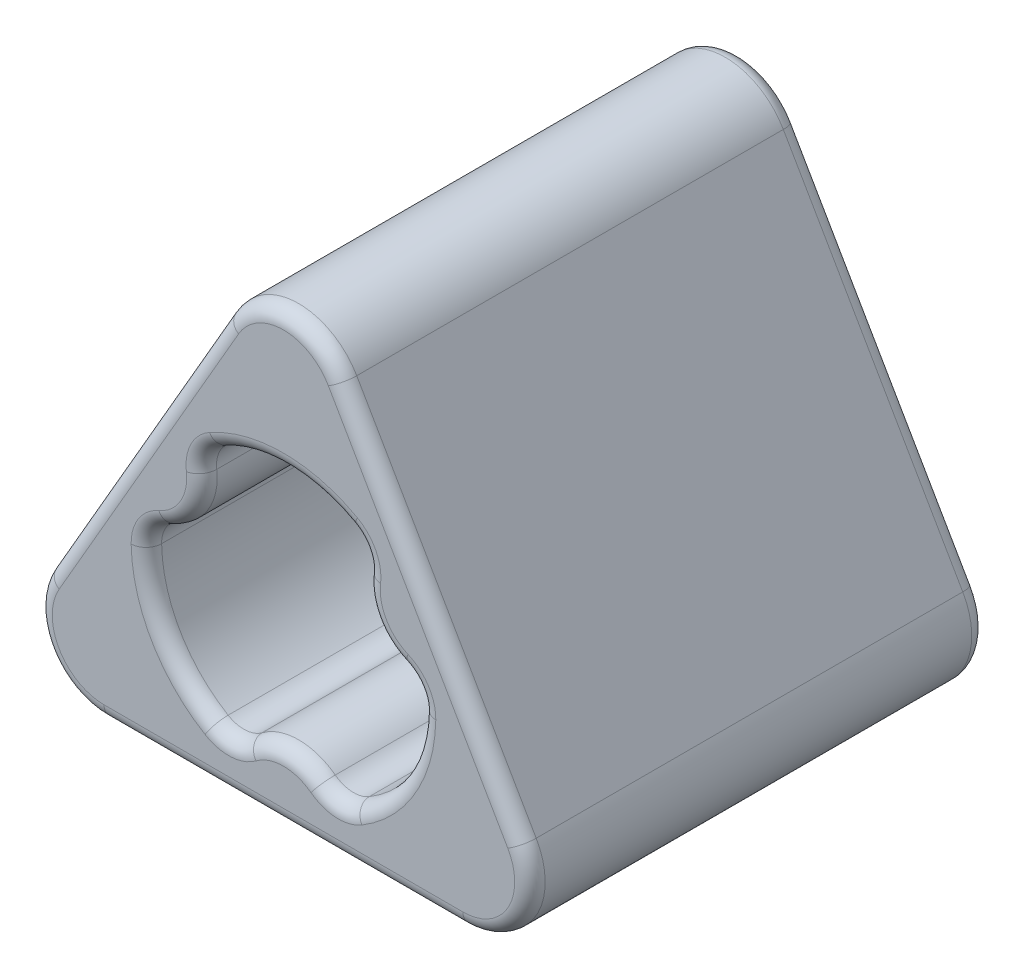
from build123d import *

# Parameters (mm, degrees)
EXTRUDE_1_DEPTH = 15
FILLET_1_R      = 2.2
FILLET_2_R      = 1
FILLET_3_R      = 0.5


with BuildPart() as part:
    # 스케치1 → 보스-돌출1 (new body)
    with BuildSketch(Plane.XY):
        Polygon((0, 11.2), (-9.699484522, -5.6), (9.699484522, -5.6), align=None)
        with BuildLine():
            ThreePointArc((-2.839585183, 3.49095345), (0, 4.5), (2.839585183, 3.49095345))
            ThreePointArc((2.839585183, 3.49095345), (2.944486373, 1.7), (4.443046962, 0.71367618))
            ThreePointArc((4.443046962, 0.71367618), (3.897114317, -2.25), (1.603461779, -4.20462963))
            ThreePointArc((1.603461779, -4.20462963), (0, -3.4), (-1.603461779, -4.20462963))
            ThreePointArc((-1.603461779, -4.20462963), (-3.897114317, -2.25), (-4.443046962, 0.71367618))
            ThreePointArc((-4.443046962, 0.71367618), (-2.944486373, 1.7), (-2.839585183, 3.49095345))
        make_face(mode=Mode.SUBTRACT)
    extrude(amount=EXTRUDE_1_DEPTH)

    # 필렛1
    fillet_1_edges = [part.edges().sort_by_distance(p)[0] for p in [
        (-9.699484522, -5.6, 7.5),
        (9.699484522, -5.6, 7.5),
        (0, 11.2, 7.5),
    ]]
    fillet(fillet_1_edges, radius=FILLET_1_R)

    # 필렛2
    fillet_2_edges = [part.edges().sort_by_distance(p)[0] for p in [
        (2.839585183, 3.49095345, 7.5),
        (4.443046962, 0.71367618, 7.5),
        (1.603461779, -4.20462963, 7.5),
        (-1.603461779, -4.20462963, 7.5),
        (-4.443046962, 0.71367618, 7.5),
        (-2.839585183, 3.49095345, 7.5),
    ]]
    fillet(fillet_2_edges, radius=FILLET_2_R)

    # 필렛3
    fillet_3_edges = [part.edges().sort_by_distance(p)[0] for p in [
        (7.794228634, -4.5, 0),
        (0, -5.6, 0),
        (-7.794228634, -4.5, 0),
        (-4.849742261, 2.8, 0),
        (0, 9, 0),
        (7.794228634, -4.5, 15),
        (0, -5.6, 15),
        (-7.794228634, -4.5, 15),
        (-4.849742261, 2.8, 15),
        (0, 9, 15),
        (4.849742261, 2.8, 0),
        (4.849742261, 2.8, 15),
        (0, 4.5, 0),
        (2.588974622, 3.51494244, 0),
        (2.944486373, 1.7, 0),
        (4.338516757, 0.484646573, 0),
        (3.897114317, -2.25, 0),
        (1.749542135, -3.999589013, 0),
        (0, -3.4, 0),
        (-1.749542135, -3.999589013, 0),
        (-3.897114317, -2.25, 0),
        (-4.338516757, 0.484646573, 0),
        (-2.944486373, 1.7, 0),
        (-4.338516757, 0.484646573, 15),
        (-3.897114317, -2.25, 15),
        (-1.749542135, -3.999589013, 15),
        (0, -3.4, 15),
        (1.749542135, -3.999589013, 15),
        (3.897114317, -2.25, 15),
        (4.338516757, 0.484646573, 15),
        (2.944486373, 1.7, 15),
        (2.588974622, 3.51494244, 15),
        (0, 4.5, 15),
        (-2.588974622, 3.51494244, 15),
        (-2.588974622, 3.51494244, 0),
        (-2.944486373, 1.7, 15),
    ]]
    fillet(fillet_3_edges, radius=FILLET_3_R)


solid = part.part
